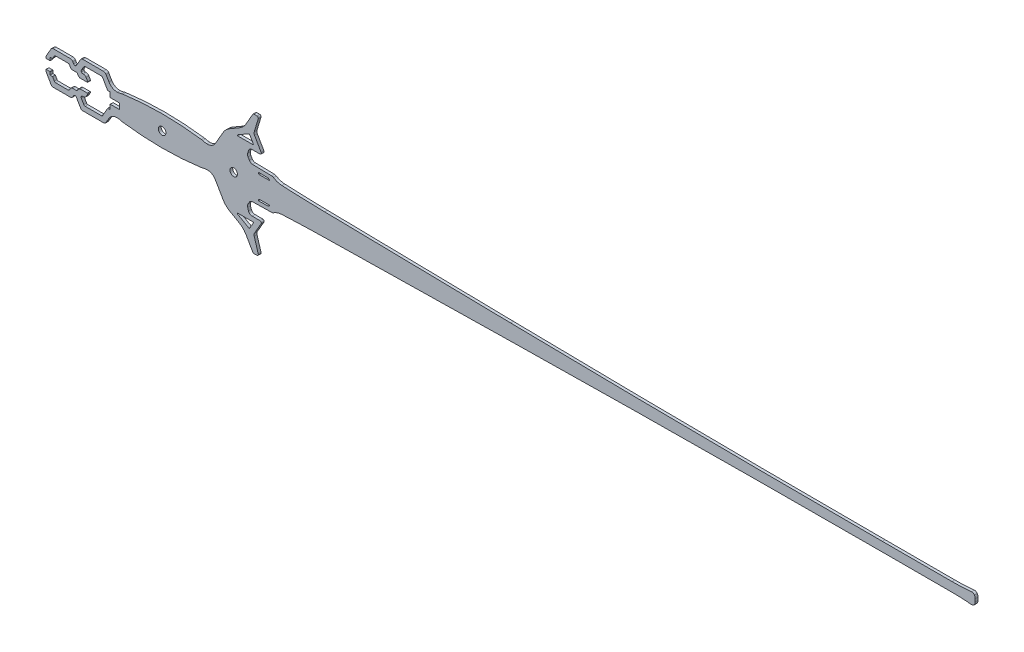
from build123d import *

# Parameters (mm, degrees)
SKETCH_1_R      = 4.05
EXTRUDE_1_DEPTH = 1.5
FILLET_1_R      = 4
FILLET_2_R      = 1.5
FILLET_3_R      = 20
FILLET_4_R      = 10
FILLET_5_R      = 0.5
FILLET_7_R      = 1.5
FILLET_8_R      = 3
CHAMFER_1_SIZE  = 0.1
FILLET_9_R      = 0.5
FILLET_10_R     = 0.4


with BuildPart() as part:
    # 草图1 → 凸台-拉伸1 (new, symmetric)
    with BuildSketch(Plane.XY):
        with BuildLine():
            Line((3.593883637, 47), (9, 65))
            Line((9, 65), (3, 65))
            Line((3, 65), (-7.392304845, 47))
            Line((-7.392304845, 47), (-26.858983849, 35.760907637))
            Line((-26.858983849, 35.760907637), (-40, 13))
            ThreePointArc((-40, 13), (-46, 12), (-52, 13))
            ThreePointArc((-52, 13), (-95, 16), (-138, 13))
            ThreePointArc((-138, 13), (-144, 12), (-150, 13))
            Line((-150, 13), (-156.350852961, 24))
            Line((-156.350852961, 24), (-182, 24))
            Line((-182, 24), (-187.773502692, 14))
            Line((-187.773502692, 14), (-189.773502692, 14))
            Line((-189.773502692, 14), (-192.082903769, 18))
            Line((-192.082903769, 18), (-213.75055535, 18))
            Line((-213.75055535, 18), (-220, 7.175644347))
            Line((-220, 7.175644347), (-220, 5.05))
            Line((-220, 5.05), (-215.5, 5.05))
            Line((-215.5, 5.05), (-215.5, 8.3))
            Line((-215.5, 8.3), (-213, 8.3))
            Line((-213, 8.3), (-210.575128869, 12.5))
            Line((-210.575128869, 12.5), (-195.258330249, 12.5))
            Line((-195.258330249, 12.5), (-192.948929172, 8.5))
            Line((-192.948929172, 8.5), (-186.581793069, 8.5))
            Line((-186.581793069, 8.5), (-184.58993464, 5.05))
            Line((-184.58993464, 5.05), (-174.637306696, 5.05))
            Line((-174.637306696, 5.05), (-177.812733176, 10.55))
            Line((-177.812733176, 10.55), (-181.41450816, 10.55))
            Line((-181.41450816, 10.55), (-182.41450816, 12.282050808))
            Line((-182.41450816, 12.282050808), (-178.824573519, 18.5))
            Line((-178.824573519, 18.5), (-159.526279442, 18.5))
            Line((-159.526279442, 18.5), (-153.637306696, 8.3))
            Line((-153.637306696, 8.3), (-150.937306696, 8.3))
            Line((-150.937306696, 8.3), (-150.937306696, 3.05))
            Line((-150.937306696, 3.05), (-140.637306696, 3.05))
            Line((-140.637306696, 3.05), (-140.637306696, -3.05))
            Line((-140.637306696, -3.05), (-150.937306696, -3.05))
            Line((-150.937306696, -3.05), (-150.937306696, -8.3))
            Line((-150.937306696, -8.3), (-153.637306696, -8.3))
            Line((-153.637306696, -8.3), (-159.526279442, -18.5))
            Line((-159.526279442, -18.5), (-178.824573519, -18.5))
            Line((-178.824573519, -18.5), (-182.41450816, -12.282050808))
            Line((-182.41450816, -12.282050808), (-181.41450816, -10.55))
            Line((-181.41450816, -10.55), (-177.812733176, -10.55))
            Line((-177.812733176, -10.55), (-174.637306696, -5.05))
            Line((-174.637306696, -5.05), (-184.58993464, -5.05))
            Line((-184.58993464, -5.05), (-186.581793069, -8.5))
            Line((-186.581793069, -8.5), (-192.948929172, -8.5))
            Line((-192.948929172, -8.5), (-195.258330249, -12.5))
            Line((-195.258330249, -12.5), (-210.575128869, -12.5))
            Line((-210.575128869, -12.5), (-213, -8.3))
            Line((-213, -8.3), (-215.5, -8.3))
            Line((-215.5, -8.3), (-215.5, -5.05))
            Line((-215.5, -5.05), (-220, -5.05))
            Line((-220, -5.05), (-220, -7.175644347))
            Line((-220, -7.175644347), (-213.75055535, -18))
            Line((-213.75055535, -18), (-192.082903769, -18))
            Line((-192.082903769, -18), (-189.773502692, -14))
            Line((-189.773502692, -14), (-187.773502692, -14))
            Line((-187.773502692, -14), (-182, -24))
            Line((-182, -24), (-156.350852961, -24))
            Line((-156.350852961, -24), (-150, -13))
            ThreePointArc((-150, -13), (-144, -12), (-138, -13))
            ThreePointArc((-138, -13), (-95, -16), (-52, -13))
            ThreePointArc((-52, -13), (-46, -12), (-40, -13))
            Line((-40, -13), (-26.858983849, -35.760907637))
            Line((-26.858983849, -35.760907637), (-7.392304845, -47))
            Line((-7.392304845, -47), (3, -65))
            Line((3, -65), (9, -65))
            Line((9, -65), (3.593883637, -47))
            Line((3.593883637, -47), (12.831487944, -31))
            Line((12.831487944, -31), (-1.21155313, -31))
            Line((-1.21155313, -31), (-3.464101615, -23.5))
            Line((-3.464101615, -23.5), (0, -17.5))
            Line((0, -17.5), (24, -17))
            ThreePointArc((24, -17), (28.745368539, -14.52248154), (34, -13.5))
            ThreePointArc((34, -13.5), (56.994338044, -12.576366694), (80, -12))
            Line((80, -12), (280, -8.499866021))
            ThreePointArc((280, -8.499866021), (479.992344483, -5.874983251), (680, -5))
            Line((680, -5), (755, -5))
            ThreePointArc((755, -5), (765.511898021, -5.250141563), (776, -6))
            ThreePointArc((776, -6), (777.833261728, -5.654865592), (779.2, -4.385222799))
            ThreePointArc((779.2, -4.385222799), (779.79629696, -2.997039629), (780, -1.5))
            Line((780, -1.5), (780, 1.5))
            ThreePointArc((780, 1.5), (779.79629696, 2.997039629), (779.2, 4.385222799))
            ThreePointArc((779.2, 4.385222799), (777.833261728, 5.654865592), (776, 6))
            ThreePointArc((776, 6), (765.511898021, 5.250141563), (755, 5))
            Line((755, 5), (680, 5))
            ThreePointArc((680, 5), (479.992344483, 5.874983251), (280, 8.499866021))
            Line((280, 8.499866021), (80, 12))
            ThreePointArc((80, 12), (56.994338044, 12.576366694), (34, 13.5))
            ThreePointArc((34, 13.5), (28.745368539, 14.52248154), (24, 17))
            Line((24, 17), (0, 17.5))
            Line((0, 17.5), (-3.464101615, 23.5))
            Line((-3.464101615, 23.5), (-1.21155313, 31))
            Line((-1.21155313, 31), (12.831487944, 31))
            Line((12.831487944, 31), (3.593883637, 47))
        make_face()
        Polygon((-1.165803205, 44.244019437), (3.593883637, 36), (-15.444863729, 36), align=None, mode=Mode.SUBTRACT)
        with Locations((-95, 0)):
            Circle(SKETCH_1_R, mode=Mode.SUBTRACT)
        with Locations((-18, 0)):
            Circle(SKETCH_1_R, mode=Mode.SUBTRACT)
        with BuildLine():
            ThreePointArc((19.240999924, 13.098277874), (20.304094538, 12.269386035), (21.411016833, 11.5))
            Line((21.411016833, 11.5), (9.237604307, 11.5))
            Line((9.237604307, 11.5), (8.181816848, 13.328677521))
            Line((8.181816848, 13.328677521), (19.240999924, 13.098277874))
        make_face(mode=Mode.SUBTRACT)
        with BuildLine():
            Line((19.240999924, -13.098277874), (8.181816848, -13.328677521))
            Line((8.181816848, -13.328677521), (9.237604307, -11.5))
            Line((9.237604307, -11.5), (21.411016833, -11.5))
            ThreePointArc((21.411016833, -11.5), (20.304094538, -12.269386035), (19.240999924, -13.098277874))
        make_face(mode=Mode.SUBTRACT)
        Polygon((-15.444863729, -36), (3.593883637, -36), (-1.165803205, -44.244019437), align=None, mode=Mode.SUBTRACT)
    extrude(amount=EXTRUDE_1_DEPTH, both=True)

    # 圆角1
    fillet_1_edges = [part.edges().sort_by_distance(p)[0] for p in [
        (3.593883637, 47, 0),
        (3.593883637, -47, 0),
        (24, -17, 0),
        (24, 17, 0),
        (-1.21155313, -31, 0),
        (-1.21155313, 31, 0),
        (-3.464101615, 23.5, 0),
        (0, 17.5, 0),
        (-3.464101615, -23.5, 0),
        (0, -17.5, 0),
    ]]
    fillet(fillet_1_edges, radius=FILLET_1_R)

    # 圆角2
    fillet_2_edges = [part.edges().sort_by_distance(p)[0] for p in [
        (12.831487944, -31, 0),
        (12.831487944, 31, 0),
        (3, 65, 0),
        (9, 65, 0),
        (3, -65, 0),
        (9, -65, 0),
    ]]
    fillet(fillet_2_edges, radius=FILLET_2_R)

    # 圆角3
    fillet_3_edges = [part.edges().sort_by_distance(p)[0] for p in [
        (-26.858983849, -35.760907637, 0),
        (-7.392304845, -47, 0),
        (-26.858983849, 35.760907637, 0),
        (-7.392304845, 47, 0),
    ]]
    fillet(fillet_3_edges, radius=FILLET_3_R)

    # 圆角4
    fillet_4_edges = [part.edges().sort_by_distance(p)[0] for p in [
        (-138, -13, 0),
        (-138, 13, 0),
        (-150, 13, 0),
        (-150, -13, 0),
        (-52, -13, 0),
        (-40, -13, 0),
        (-52, 13, 0),
        (-40, 13, 0),
    ]]
    fillet(fillet_4_edges, radius=FILLET_4_R)

    # 圆角5
    fillet_5_edges = [part.edges().sort_by_distance(p)[0] for p in [
        (-15.444863729, -36, 0),
        (-1.165803205, -44.244019437, 0),
        (3.593883637, -36, 0),
        (-15.444863729, 36, 0),
        (3.593883637, 36, 0),
        (-1.165803205, 44.244019437, 0),
    ]]
    fillet(fillet_5_edges, radius=FILLET_5_R)

    # 圆角7
    fillet_7_edges = [part.edges().sort_by_distance(p)[0] for p in [
        (-210.575128869, 12.5, 0),
        (-210.575128869, -12.5, 0),
        (-195.258330249, -12.5, 0),
        (-186.581793069, 8.5, 0),
        (-195.258330249, 12.5, 0),
        (-178.824573519, 18.5, 0),
        (-159.526279442, 18.5, 0),
        (-159.526279442, -18.5, 0),
        (-178.824573519, -18.5, 0),
        (-186.581793069, -8.5, 0),
        (-182.41450816, 12.282050808, 0),
        (-181.41450816, 10.55, 0),
        (-181.41450816, -10.55, 0),
        (-182.41450816, -12.282050808, 0),
        (-189.773502692, -14, 0),
        (-187.773502692, -14, 0),
        (-187.773502692, 14, 0),
        (-189.773502692, 14, 0),
    ]]
    fillet(fillet_7_edges, radius=FILLET_7_R)

    # 圆角8
    fillet_8_edges = [part.edges().sort_by_distance(p)[0] for p in [
        (-213.75055535, 18, 0),
        (-213.75055535, -18, 0),
        (-192.082903769, -18, 0),
        (-192.082903769, 18, 0),
        (-177.812733176, 10.55, 0),
        (-177.812733176, -10.55, 0),
        (-184.58993464, 5.05, 0),
        (-192.948929172, 8.5, 0),
        (-192.948929172, -8.5, 0),
        (-184.58993464, -5.05, 0),
        (-182, 24, 0),
        (-156.350852961, 24, 0),
        (-156.350852961, -24, 0),
        (-182, -24, 0),
    ]]
    fillet(fillet_8_edges, radius=FILLET_8_R)

    # 倒角1
    chamfer_1_edges = [part.edges().sort_by_distance(p)[0] for p in [
        (-150.937306696, 3.05, 0),
        (-150.937306696, -3.05, 0),
        (-150.937306696, 8.3, 0),
        (-150.937306696, -8.3, 0),
        (-140.637306696, 3.05, 0),
        (-140.637306696, -3.05, 0),
        (-215.5, -5.05, 0),
        (-215.5, 5.05, 0),
        (-220, -5.05, 0),
        (-220, 5.05, 0),
    ]]
    chamfer(chamfer_1_edges, length=CHAMFER_1_SIZE)

    # 圆角9
    fillet_9_edges = [part.edges().sort_by_distance(p)[0] for p in [
        (-174.637306696, 5.05, 0),
        (-174.637306696, -5.05, 0),
    ]]
    fillet(fillet_9_edges, radius=FILLET_9_R)

    # 圆角10
    fillet_10_edges = [part.edges().sort_by_distance(p)[0] for p in [
        (19.240999924, 13.098277874, 0),
        (21.411016833, 11.5, 0),
        (9.237604307, 11.5, 0),
        (8.181816848, 13.328677521, 0),
        (9.237604307, -11.5, 0),
        (8.181816848, -13.328677521, 0),
        (19.240999924, -13.098277874, 0),
        (21.411016833, -11.5, 0),
    ]]
    fillet(fillet_10_edges, radius=FILLET_10_R)


solid = part.part
